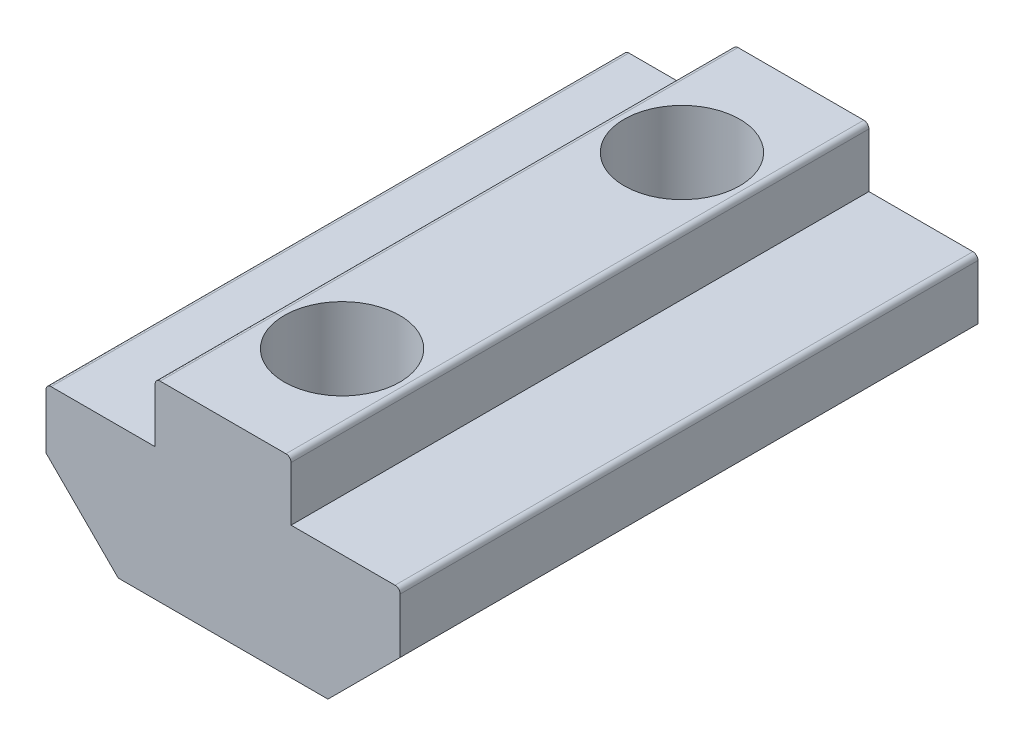
from build123d import *

# Parameters (mm, degrees)
EXTRUDE_1_DEPTH    = 34
HOLE_WIZARD_M8_1_D = 6.8


with BuildPart() as part:
    # 草图1 → 凸台-拉伸1 (new body)
    with BuildSketch(Plane.XY):
        with BuildLine():
            Line((-6.350003001, -5.180792426), (5.989996999, -5.180792426))
            Line((5.989996999, -5.180792426), (10.239996999, -0.930792426))
            Line((10.239996999, -0.930792426), (10.239996999, 2.299207574))
            ThreePointArc((10.239996999, 2.299207574), (10.152129033, 2.511339608), (9.939996999, 2.599207574))
            Line((9.939996999, 2.599207574), (3.819996999, 2.599207574))
            Line((3.819996999, 2.599207574), (3.819996999, 5.789207574))
            ThreePointArc((3.819996999, 5.789207574), (3.732129033, 6.001339608), (3.519996999, 6.089207574))
            Line((3.519996999, 6.089207574), (-3.880003001, 6.089207574))
            ThreePointArc((-3.880003001, 6.089207574), (-4.092135036, 6.001339608), (-4.180003001, 5.789207574))
            Line((-4.180003001, 5.789207574), (-4.180003001, 2.599207574))
            Line((-4.180003001, 2.599207574), (-10.300003001, 2.599207574))
            ThreePointArc((-10.300003001, 2.599207574), (-10.512135036, 2.511339608), (-10.600003001, 2.299207574))
            Line((-10.600003001, 2.299207574), (-10.600003001, -0.930792426))
            Line((-10.600003001, -0.930792426), (-6.350003001, -5.180792426))
        make_face()
    extrude(amount=EXTRUDE_1_DEPTH)

    # M8 螺纹孔1 (through all)
    with Locations(Plane(origin=(0, 6.089207574, 0), x_dir=(-1, 0, 0), z_dir=(0, 1, 0))):
        with Locations((0.180003001, 7), (0.180003001, 27)):
            Hole(HOLE_WIZARD_M8_1_D / 2)


solid = part.part
